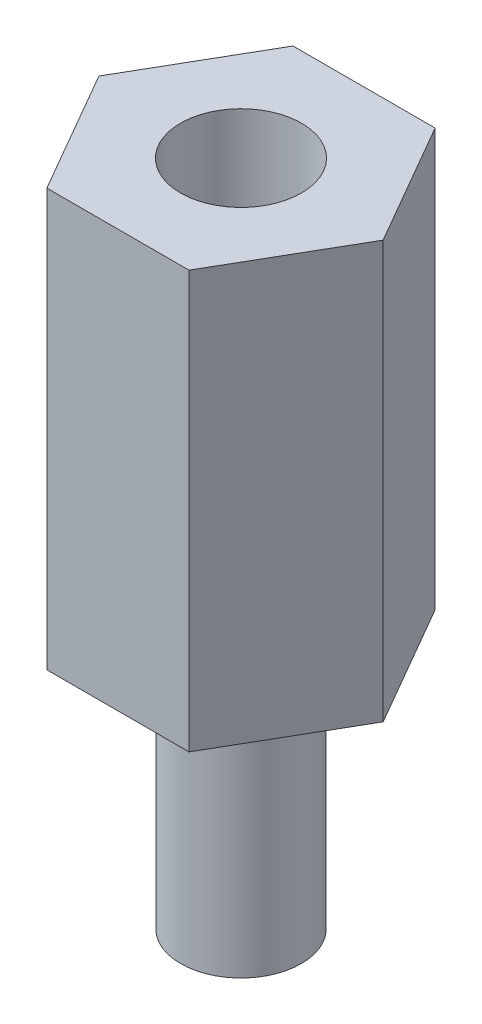
from build123d import *

# Parameters (mm, degrees)
BOSS_EXTRUDE1_DEPTH = 10
SKETCH2_R           = 1.445
BOSS_EXTRUDE2_DEPTH = 6
SKETCH4_R           = 1.45
CUT_EXTRUDE1_DEPTH  = 6


with BuildPart() as part:
    # Sketch1 → Boss-Extrude1 (new body)
    with BuildSketch(Plane(origin=(0, 0, 0), x_dir=(1, 0, 0), z_dir=(0, 1, 0))):
        Polygon((3.406366588, 0), (1.703183294, 2.95), (-1.703183294, 2.95), (-3.406366588, 0), (-1.703183294, -2.95), (1.703183294, -2.95), align=None)
    extrude(amount=BOSS_EXTRUDE1_DEPTH)

    # Sketch2 → Boss-Extrude2 (add)
    with BuildSketch(Plane.XZ):
        with Locations(Location((0, 0, 0), (0, 0, 90))):
            Circle(SKETCH2_R)
    extrude(amount=BOSS_EXTRUDE2_DEPTH)

    # Sketch4 → Cut-Extrude1 (cut)
    with BuildSketch(Plane(origin=(0, 10, 0), x_dir=(1, 0, 0), z_dir=(0, 1, 0))):
        with Locations(Location((0, 0, 0), (0, 0, 270))):
            Circle(SKETCH4_R)
    extrude(amount=-CUT_EXTRUDE1_DEPTH, mode=Mode.SUBTRACT)


solid = part.part
